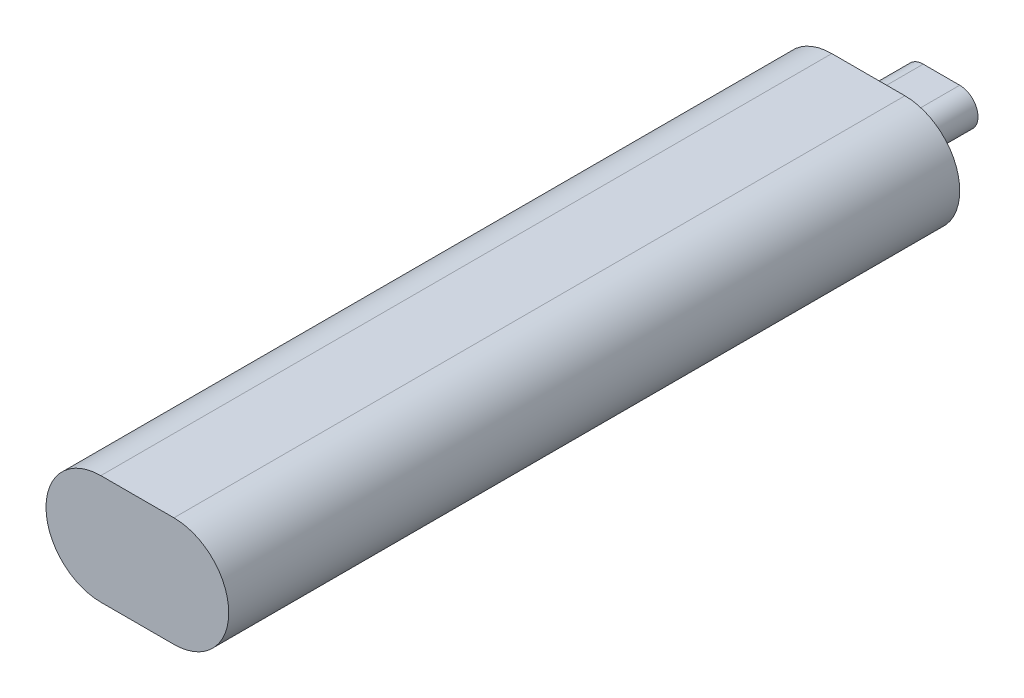
from build123d import *

# Parameters (mm, degrees)
EXTRUDE_1_DEPTH = 100
EXTRUDE_2_DEPTH = 20


with BuildPart() as part:
    # 草图1 → 凸台-拉伸1 (new, symmetric)
    with BuildSketch(Plane.XY):
        with BuildLine():
            Line((-10, 15), (10, 15))
            ThreePointArc((10, 15), (25, 0), (10, -15))
            Line((10, -15), (-10, -15))
            ThreePointArc((-10, -15), (-25, 0), (-10, 15))
        make_face()
    extrude(amount=EXTRUDE_1_DEPTH, both=True)

    # 草图2 → 凸台-拉伸2 (add)
    with BuildSketch(Plane(origin=(0, 0, -100), x_dir=(-1, 0, 0), z_dir=(0, 0, -1))):
        with BuildLine():
            Line((-5, 5), (5, 5))
            ThreePointArc((5, 5), (10, 0), (5, -5))
            Line((5, -5), (-5, -5))
            ThreePointArc((-5, -5), (-10, 0), (-5, 5))
        make_face()
    extrude(amount=EXTRUDE_2_DEPTH)


solid = part.part
